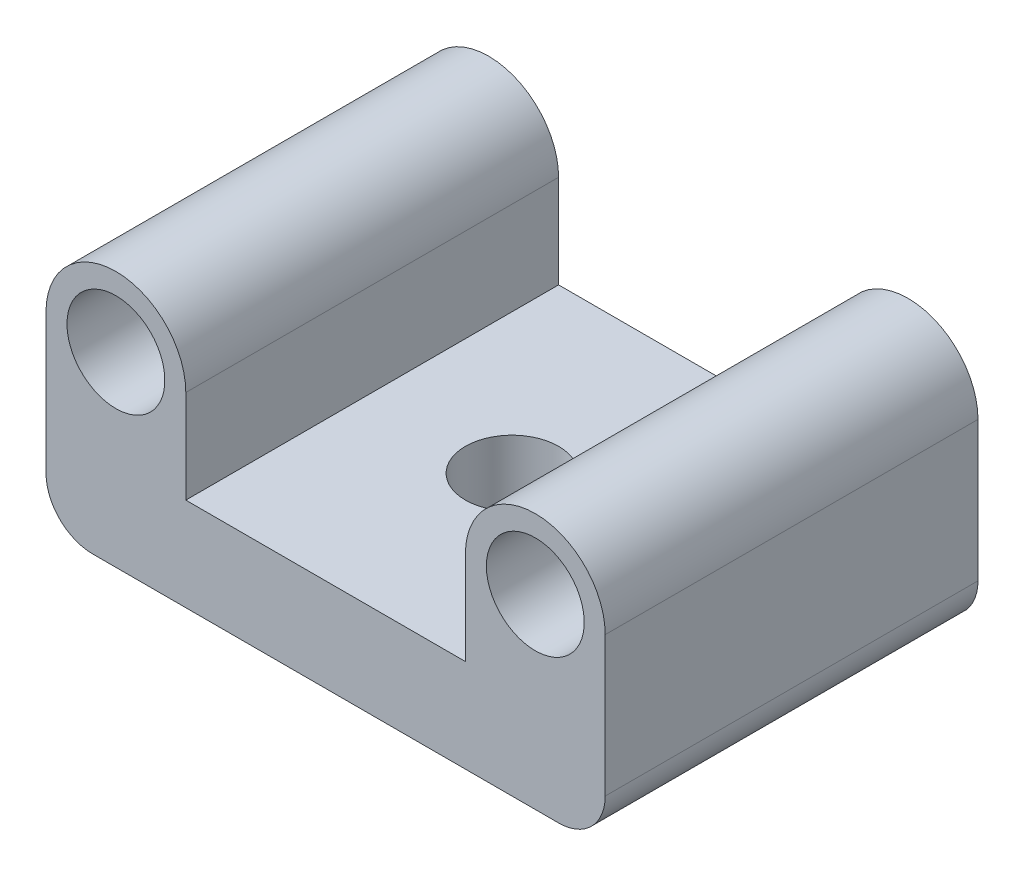
from build123d import *

# Parameters (mm, degrees)
SKETCH_1_W          = 12
SKETCH_1_H          = 8
EXTRUDE_1_DEPTH     = 2
EXTRUDE_6_DEPTH     = 8
SKETCH_11_R         = 1.05
CUT_EXTRUDE_1_DEPTH = 16.43534904
FILLET_3_R          = 1
SKETCH_12_R         = 1
CUT_EXTRUDE_2_DEPTH = 2
EXTRUDE_START       = 1
SKETCH_13_R         = 1.5
SKETCH_13_R_2       = 1
EXTRUDE_7_DEPTH     = 1


with BuildPart() as part:
    # 草图1 → 凸台-拉伸1 (new body)
    with BuildSketch(Plane(origin=(0, 0, 0), x_dir=(1, 0, 0), z_dir=(0, 1, 0))):
        with Locations((6, 0)):
            Rectangle(SKETCH_1_W, SKETCH_1_H)
    extrude(amount=EXTRUDE_1_DEPTH)

    # 草图10 → 凸台-拉伸6 (add)
    with BuildSketch(Plane(origin=(0, 0, -4), x_dir=(-1, 0, 0), z_dir=(0, 0, -1))):
        with BuildLine():
            Line((-12, 2), (-12, 4))
            ThreePointArc((-12, 4), (-10.5, 5.5), (-9, 4))
            Line((-9, 4), (-9, 2))
            Line((-9, 2), (-12, 2))
        make_face()
        with BuildLine():
            Line((-3, 2), (0, 2))
            Line((0, 2), (0, 4))
            ThreePointArc((0, 4), (-1.5, 5.5), (-3, 4))
            Line((-3, 4), (-3, 2))
        make_face()
    extrude(amount=-EXTRUDE_6_DEPTH)

    # 草图11 → 切除-拉伸1 (cut, through all)
    with BuildSketch(Plane(origin=(0, 0, -4), x_dir=(-1, 0, 0), z_dir=(0, 0, -1))):
        with Locations((-1.5, 4)):
            Circle(SKETCH_11_R)
        with Locations((-10.5, 4)):
            Circle(SKETCH_11_R)
    extrude(amount=-CUT_EXTRUDE_1_DEPTH, mode=Mode.SUBTRACT)

    # 圆角3
    fillet_3_edges = [part.edges().sort_by_distance(p)[0] for p in [
        (12, 0, 0),
        (0, 0, 0),
    ]]
    fillet(fillet_3_edges, radius=FILLET_3_R)

    # 草图12 → 切除-拉伸2 (cut)
    with BuildSketch(Plane.XZ):
        with Locations(Location((6, 0, 0), (0, 0, 270))):
            Circle(SKETCH_12_R)
    extrude(amount=-CUT_EXTRUDE_2_DEPTH, mode=Mode.SUBTRACT)

    # 草图13 → 凸台-拉伸7 (add)
    with BuildSketch(Plane.XZ.offset(EXTRUDE_START)):
        with Locations(Location((6, 0, 0), (0, 0, 90))):
            Circle(SKETCH_13_R)
        with Locations(Location((6, 0, 0), (0, 0, 270))):
            Circle(SKETCH_13_R_2, mode=Mode.SUBTRACT)
    extrude(amount=-EXTRUDE_7_DEPTH)


solid = part.part
